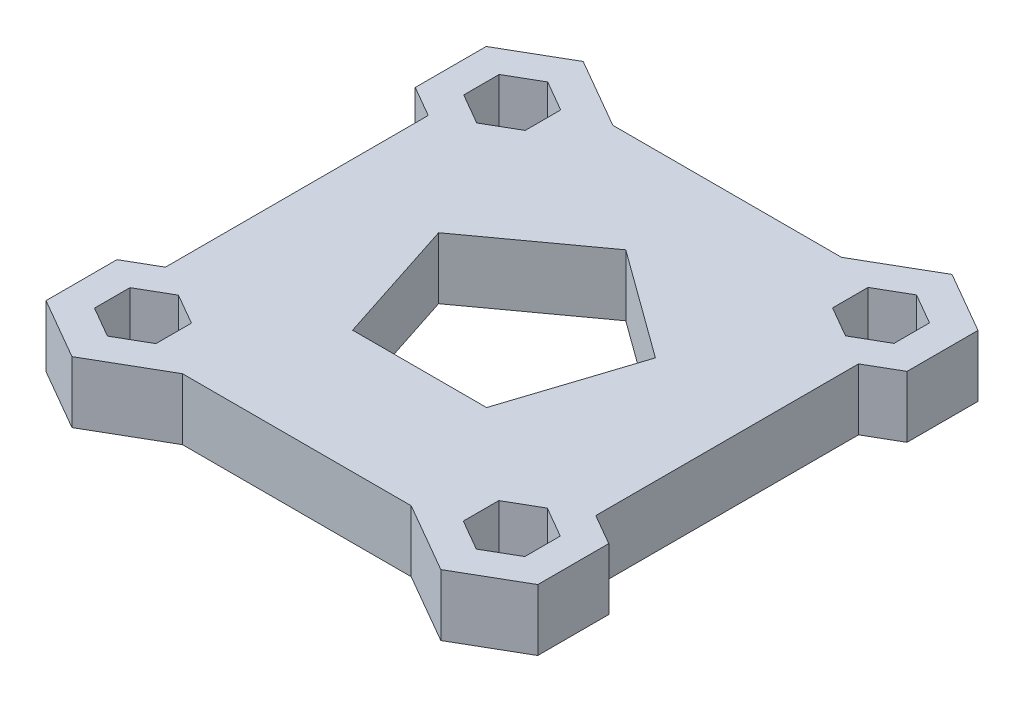
from build123d import *

# Parameters (mm, degrees)
BOSS_EXTRUDE1_DEPTH = 12.7


with BuildPart() as part:
    # Sketch2 → Boss-Extrude1 (new body)
    with BuildSketch(Plane(origin=(0, 0, 0), x_dir=(1, 0, 0), z_dir=(0, 1, 0))):
        Polygon((-23.625933555, 44.491909321), (23.625933555, 44.491909321), (38.1, 52.84851548), (50.8, 45.516167061), (50.8, 30.851470224), (44.45, 27.185296014), (44.45, -27.101477372), (50.8, -30.767651581), (50.8, -45.432348419), (38.1, -52.764696837), (23.625933555, -44.408090679), (-23.625933555, -44.408090679), (-38.1, -52.764696837), (-50.8, -45.432348419), (-50.8, -30.767651581), (-44.45, -27.101477372), (-44.45, 27.185296014), (-50.8, 30.851470224), (-50.8, 45.516167061), (-38.1, 52.84851548), align=None)
        Polygon((-38.1, 45.516167061), (-44.45, 41.849992852), (-44.45, 34.517644433), (-38.1, 30.851470224), (-31.75, 34.517644433), (-31.75, 41.849992852), align=None, mode=Mode.SUBTRACT)
        Polygon((38.1, 45.516167061), (31.75, 41.849992852), (31.75, 34.517644433), (38.1, 30.851470224), (44.45, 34.517644433), (44.45, 41.849992852), align=None, mode=Mode.SUBTRACT)
        Polygon((-38.1, -30.767651581), (-44.45, -34.433825791), (-44.45, -41.766174209), (-38.1, -45.432348419), (-31.75, -41.766174209), (-31.75, -34.433825791), align=None, mode=Mode.SUBTRACT)
        Polygon((38.1, -30.767651581), (31.75, -34.433825791), (31.75, -41.766174209), (38.1, -45.432348419), (44.45, -41.766174209), (44.45, -34.433825791), align=None, mode=Mode.SUBTRACT)
        Polygon((0, 23.547094971), (-22.394618112, 7.276452514), (-13.840635159, -19.05), (13.840635159, -19.05), (22.394618112, 7.276452514), align=None, mode=Mode.SUBTRACT)
    extrude(amount=BOSS_EXTRUDE1_DEPTH)


solid = part.part
